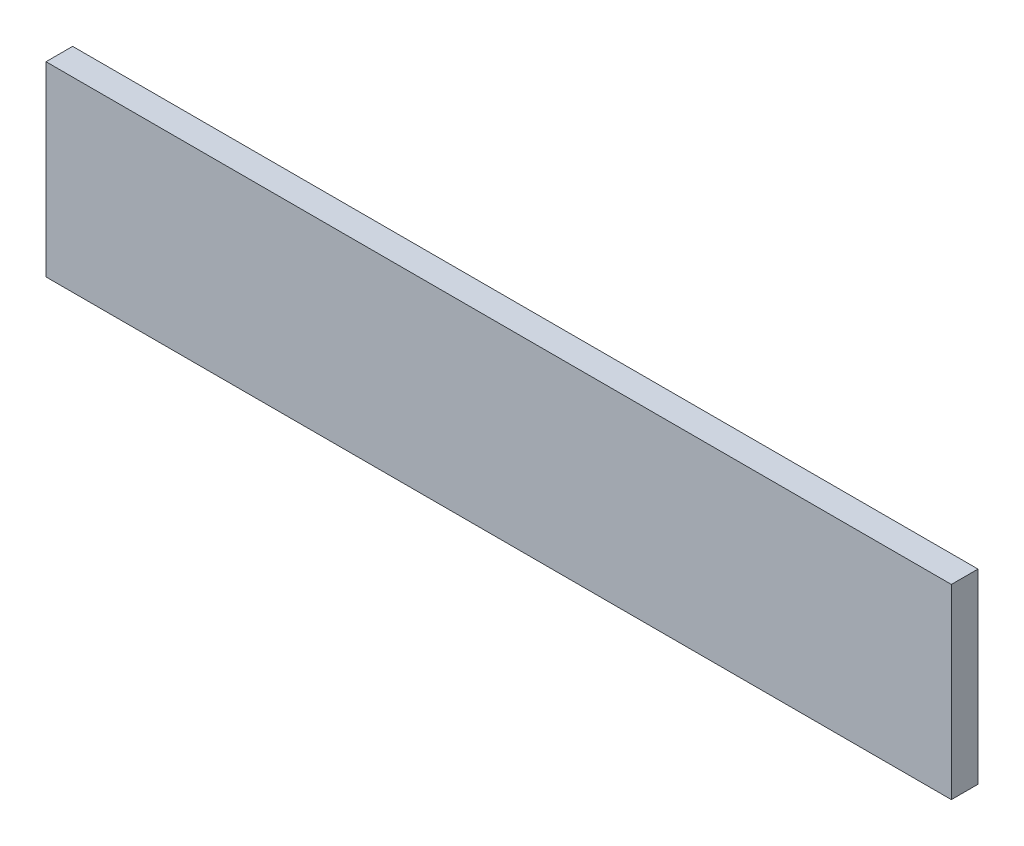
from build123d import *

# Parameters (mm, degrees)
SKETCH1_W           = 340
SKETCH1_H           = 70
BOSS_EXTRUDE1_DEPTH = 10


with BuildPart() as part:
    # Sketch1 → Boss-Extrude1 (new body)
    with BuildSketch(Plane.XY):
        with Locations((100, 28)):
            Rectangle(SKETCH1_W, SKETCH1_H)
    extrude(amount=BOSS_EXTRUDE1_DEPTH)


solid = part.part
